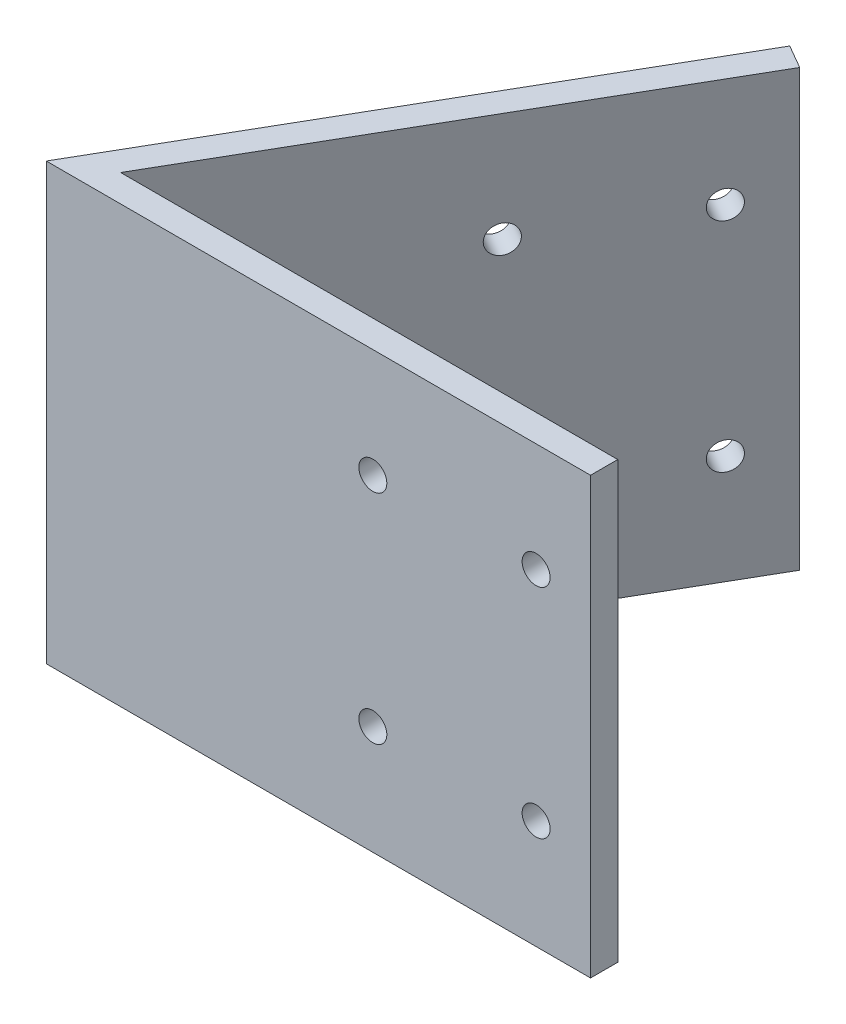
from build123d import *

# Parameters (mm, degrees)
BOSS_EXTRUDE1_DEPTH              = 50.8
F_30_0_1285_DIAMETER_HOLE1_D     = 3.2639
F_30_0_1285_DIAMETER_HOLE2_D     = 3.2639
F_30_0_1285_DIAMETER_HOLE2_DEPTH = 25.4
F_30_0_1285_DIAMETER_HOLE2_TIP   = 0.980574487


with BuildPart() as part:
    # Sketch1 → Boss-Extrude1 (new body)
    with BuildSketch(Plane(origin=(0, 0, 0), x_dir=(1, 0, 0), z_dir=(0, 1, 0))):
        Polygon((0, 0), (31.75, 54.99261314), (34.499630657, 53.40511314), (5.499261314, 3.175), (63.5, 3.175), (63.5, 0), align=None)
    extrude(amount=BOSS_EXTRUDE1_DEPTH)

    # #30 (0.1285) Diameter Hole1 (through all)
    with Locations(Plane.XY):
        with Locations((57.15, 12.7), (57.15, 38.1), (38.1, 38.1), (38.1, 12.7)):
            Hole(F_30_0_1285_DIAMETER_HOLE1_D / 2)

    # #30 (0.1285) Diameter Hole2
    with Locations(Plane(origin=(0, 0, 0), x_dir=(-0.5000000000000039, 0, 0.8660254037844365), z_dir=(-0.8660254037844364, 0, -0.5000000000000038))):
        with Locations((-57.15, 38.1), (-57.15, 12.7), (-38.1, 12.7), (-38.1, 38.1)):
            Hole(F_30_0_1285_DIAMETER_HOLE2_D / 2, depth=F_30_0_1285_DIAMETER_HOLE2_DEPTH)
            with Locations((0, 0, -(F_30_0_1285_DIAMETER_HOLE2_DEPTH + F_30_0_1285_DIAMETER_HOLE2_TIP / 2))):  # 118° drill point
                Cone(0, F_30_0_1285_DIAMETER_HOLE2_D / 2, F_30_0_1285_DIAMETER_HOLE2_TIP, mode=Mode.SUBTRACT)


solid = part.part
